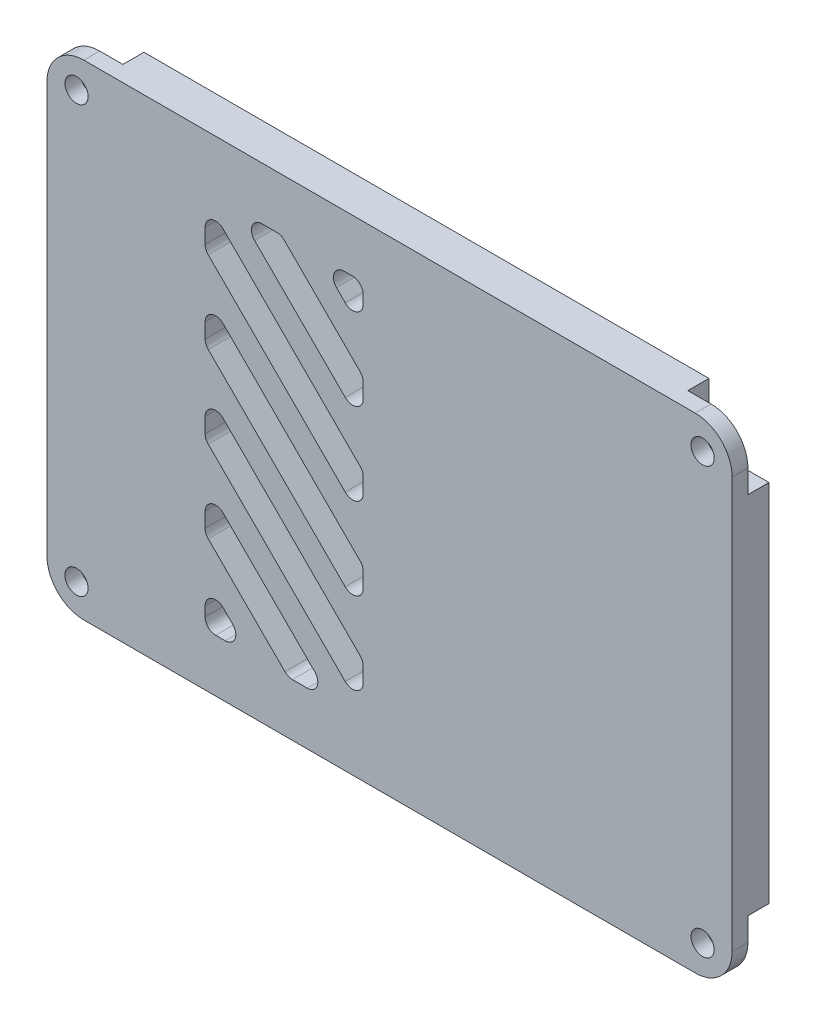
from build123d import *

# Parameters (mm, degrees)
BOSS_EXTRUDE1_DEPTH = 3.5
CUT_EXTRUDE1_DEPTH  = 10
CUT_EXTRUDE2_DEPTH  = 2
CUT_EXTRUDE3_DEPTH  = 4
FILLET2_R           = 1


with BuildPart() as part:
    # Sketch1 → Boss-Extrude1 (new body)
    with BuildSketch(Plane.XY):
        with BuildLine():
            Line((3.5, 23), (61.5, 23))
            ThreePointArc((61.5, 23), (63.974873734, 21.974873734), (65, 19.5))
            Line((65, 19.5), (65, -19.5))
            ThreePointArc((65, -19.5), (63.974873734, -21.974873734), (61.5, -23))
            Line((61.5, -23), (3.5, -23))
            ThreePointArc((3.5, -23), (1.025126266, -21.974873734), (0, -19.5))
            Line((0, -19.5), (0, 19.5))
            ThreePointArc((0, 19.5), (1.025126266, 21.974873734), (3.5, 23))
        make_face()
    extrude(amount=BOSS_EXTRUDE1_DEPTH)

    # Sketch2 → Cut-Extrude1 (cut)
    with BuildSketch(Plane.XY.offset(3.5)):
        with BuildLine():
            ThreePointArc((1.720986059, -20.413843202), (2.022182541, -20.977817459), (2.586156798, -21.279013941))
            ThreePointArc((2.586156798, -21.279013941), (3.577817459, -19.422182541), (1.720986059, -20.413843202))
        make_face()
        with BuildLine():
            ThreePointArc((2.586156798, 21.279013941), (2.022182541, 20.977817459), (1.720986059, 20.413843202))
            ThreePointArc((1.720986059, 20.413843202), (2.236022068, 19.255580129), (3.5, 19.351471863))
            ThreePointArc((3.5, 19.351471863), (3.9, 20.2), (3.5, 21.048528137))
            ThreePointArc((3.5, 21.048528137), (3.069013075, 21.266598315), (2.586156798, 21.279013941))
        make_face()
        with BuildLine():
            ThreePointArc((62.413843202, -21.279013941), (62.977817459, -20.977817459), (63.279013941, -20.413843202))
            ThreePointArc((63.279013941, -20.413843202), (61.422182541, -19.422182541), (62.413843202, -21.279013941))
        make_face()
        with BuildLine():
            ThreePointArc((63.279013941, 20.413843202), (62.977817459, 20.977817459), (62.413843202, 21.279013941))
            ThreePointArc((62.413843202, 21.279013941), (61.422182541, 19.422182541), (63.279013941, 20.413843202))
        make_face()
    extrude(amount=-CUT_EXTRUDE1_DEPTH, mode=Mode.SUBTRACT)

    # Sketch3 → Cut-Extrude2 (cut)
    with BuildSketch(Plane(origin=(0, 0, 0), x_dir=(-1, 0, 0), z_dir=(0, 0, -1))):
        with BuildLine():
            Line((-2.8, -17.3), (0, -17.3))
            Line((0, -17.3), (0, -19.5))
            ThreePointArc((0, -19.5), (-1.025126266, -21.974873734), (-3.5, -23))
            Line((-3.5, -23), (-5.7, -23))
            Line((-5.7, -23), (-5.7, -20.2))
            ThreePointArc((-5.7, -20.2), (-4.850609665, -18.149390335), (-2.8, -17.3))
        make_face()
        with BuildLine():
            Line((-2.8, 17.3), (0, 17.3))
            Line((0, 17.3), (0, 19.5))
            ThreePointArc((0, 19.5), (-1.025126266, 21.974873734), (-3.5, 23))
            Line((-3.5, 23), (-5.7, 23))
            Line((-5.7, 23), (-5.7, 20.2))
            ThreePointArc((-5.7, 20.2), (-4.850609665, 18.149390335), (-2.8, 17.3))
        make_face()
        with BuildLine():
            Line((-59.3, 20.2), (-59.3, 23))
            Line((-59.3, 23), (-61.5, 23))
            ThreePointArc((-61.5, 23), (-63.974873734, 21.974873734), (-65, 19.5))
            Line((-65, 19.5), (-65, 17.3))
            Line((-65, 17.3), (-62.2, 17.3))
            ThreePointArc((-62.2, 17.3), (-60.149390335, 18.149390335), (-59.3, 20.2))
        make_face()
        with BuildLine():
            Line((-62.2, -17.3), (-65, -17.3))
            Line((-65, -17.3), (-65, -19.5))
            ThreePointArc((-65, -19.5), (-63.974873734, -21.974873734), (-61.5, -23))
            Line((-61.5, -23), (-59.3, -23))
            Line((-59.3, -23), (-59.3, -20.2))
            ThreePointArc((-59.3, -20.2), (-60.149390335, -18.149390335), (-62.2, -17.3))
        make_face()
    extrude(amount=-CUT_EXTRUDE2_DEPTH, mode=Mode.SUBTRACT)

    # Sketch4 → Cut-Extrude3 (cut)
    with BuildSketch(Plane(origin=(0, 0, 0), x_dir=(-1, 0, 0), z_dir=(0, 0, -1))):
        Polygon((-25.757359313, 18), (-30, 18), (-30, 13.757359313), align=None)
        Polygon((-17.97918472, 18), (-22.221825407, 18), (-30, 10.221825407), (-30, 5.97918472), align=None)
        Polygon((-15, 17.443650814), (-30, 2.443650814), (-30, -1.798989873), (-15, 13.201010127), align=None)
        Polygon((-15, 9.665476221), (-30, -5.334523779), (-30, -9.577164466), (-15, 5.422835534), align=None)
        Polygon((-15, 1.887301628), (-30, -13.112698372), (-30, -17.355339059), (-15, -2.355339059), align=None)
        Polygon((-15, -10.133513652), (-15, -5.890872965), (-27.109127035, -18), (-22.866486348, -18), align=None)
        Polygon((-15, -18), (-15, -13.669047558), (-19.330952442, -18), align=None)
    extrude(amount=-CUT_EXTRUDE3_DEPTH, mode=Mode.SUBTRACT)

    # Fillet2
    fillet2_edges = [part.edges().sort_by_distance(p)[0] for p in [
        (30, -9.577164466, 1.75),
        (30, -5.334523779, 1.75),
        (15, 9.665476221, 1.75),
        (15, 5.422835534, 1.75),
        (30, -17.355339059, 1.75),
        (30, -13.112698372, 1.75),
        (15, 1.887301628, 1.75),
        (15, -2.355339059, 1.75),
        (30, 5.97918472, 1.75),
        (30, 10.221825407, 1.75),
        (22.221825407, 18, 1.75),
        (17.97918472, 18, 1.75),
        (30, -1.798989873, 1.75),
        (30, 2.443650814, 1.75),
        (15, 17.443650814, 1.75),
        (15, 13.201010127, 1.75),
        (19.330952442, -18, 1.75),
        (15, -13.669047558, 1.75),
        (15, -18, 1.75),
        (22.866486348, -18, 1.75),
        (27.109127035, -18, 1.75),
        (15, -5.890872965, 1.75),
        (15, -10.133513652, 1.75),
        (30, 13.757359313, 1.75),
        (30, 18, 1.75),
        (25.757359313, 18, 1.75),
    ]]
    fillet(fillet2_edges, radius=FILLET2_R)


solid = part.part
